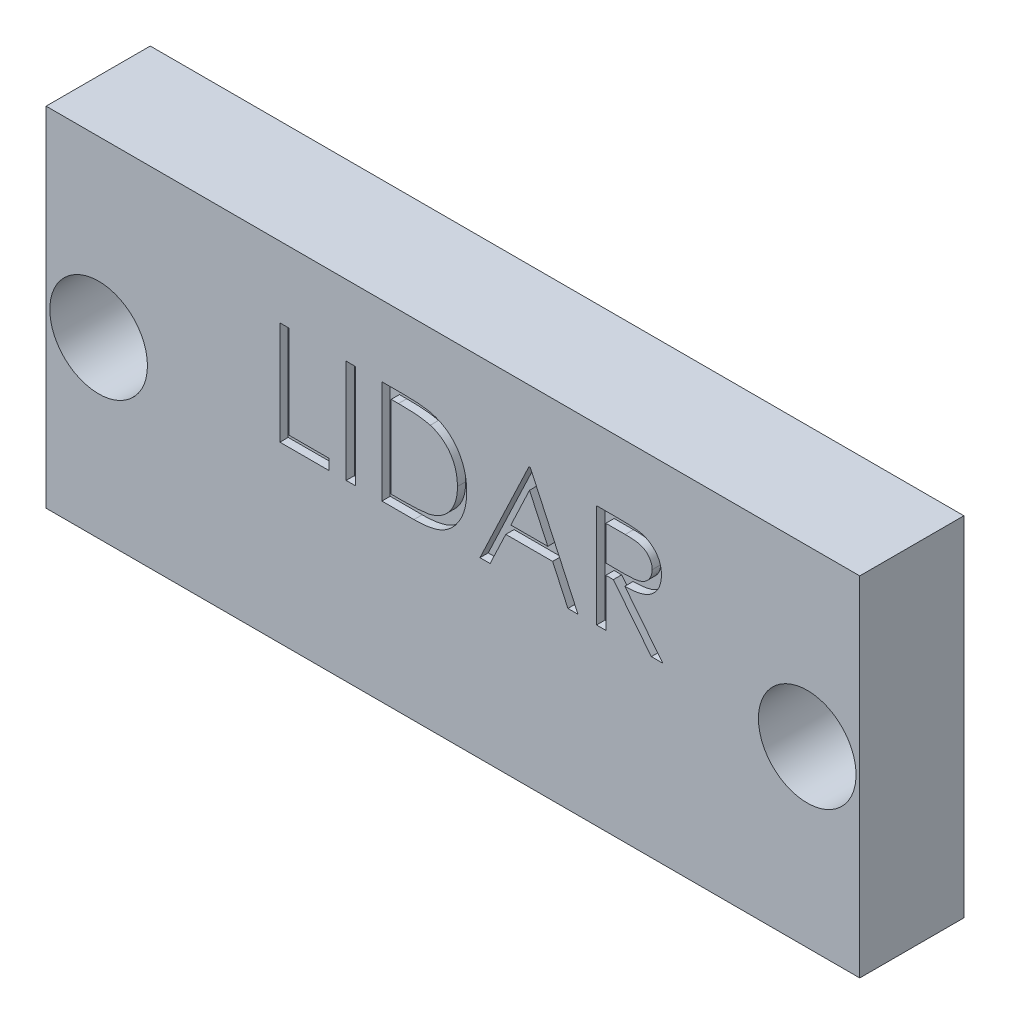
from build123d import *

# Parameters (mm, degrees)
SKETCH2_W           = 25
SKETCH2_H           = 10.7
BOSS_EXTRUDE1_DEPTH = 3.2
SKETCH3_R           = 1.5
CUT_EXTRUDE2_DEPTH  = 3.2
SKETCH4_W           = 0.284935898
SKETCH4_H           = 3.175
CUT_EXTRUDE3_DEPTH  = 0.254


with BuildPart() as part:
    # Sketch2 → Boss-Extrude1 (new body)
    with BuildSketch(Plane.XY):
        with Locations((0.072254335, -5.35)):
            Rectangle(SKETCH2_W, SKETCH2_H)
    extrude(amount=BOSS_EXTRUDE1_DEPTH)

    # Sketch3 → Cut-Extrude2 (cut)
    with BuildSketch(Plane.XY.offset(3.2)):
        with Locations((-10.814046376, -5.35)):
            Circle(SKETCH3_R)
        with Locations(Location((10.958555047, -5.35, 0), (0, 0, 180))):
            Circle(SKETCH3_R)
    extrude(amount=-CUT_EXTRUDE2_DEPTH, mode=Mode.SUBTRACT)

    # Sketch4 → Cut-Extrude3 (cut)
    # profile 1 of 5: a face of its own
    with BuildSketch(Plane.XY.offset(3.2)):
        Polygon((-5.243533556, -2.175), (-4.958597658, -2.175), (-4.958597658, -5.024358974), (-3.737443812, -5.024358974), (-3.737443812, -5.35), (-5.243533556, -5.35), align=None)
    # profile 2 of 5: a face of its own
    with BuildSketch(Plane.XY.offset(3.2)):
        with Locations((-3.065809197, -3.7625)):
            Rectangle(SKETCH4_W, SKETCH4_H)
    # profile 3 of 5: a face of its own
    with BuildSketch(Plane.XY.offset(3.2)):
        with BuildLine():
            Line((-2.109238684, -5.35), (-2.109238684, -2.175))
            Line((-2.109238684, -2.175), (-1.468132915, -2.175))
            add(Edge.make_bspline(
                [(-1.468132915, -2.175), (-1.412371761, -2.175401474), (-1.304641503, -2.17617712), (-1.148964497, -2.181095097), (-1.004924941, -2.189795019), (-0.872996561, -2.202467375), (-0.752817176, -2.218027627), (-0.644723296, -2.237531565), (-0.548155995, -2.260562263), (-0.48876586, -2.280197778), (-0.460680992, -2.289483173)],
                knots=[0, 0, 0, 0, 1.314313732, 2.53924729, 3.670748893, 4.714932338, 5.66265055, 6.526160246, 7.303039223, 8, 8, 8, 8], degree=3))
            add(Edge.make_bspline(
                [(-0.460680992, -2.289483173), (-0.423946478, -2.303481027), (-0.351310468, -2.331159311), (-0.247889721, -2.383371099), (-0.150530285, -2.442528698), (-0.05871006, -2.508710088), (0.025473546, -2.583789176), (0.105309281, -2.664576675), (0.177531209, -2.754010383), (0.243669449, -2.850235551), (0.303301083, -2.952118627), (0.355134462, -3.059465476), (0.398182013, -3.171730943), (0.433917297, -3.288602827), (0.462080869, -3.410338113), (0.481295908, -3.537078548), (0.493969591, -3.668323242), (0.495243266, -3.757381505), (0.495889521, -3.802569111)],
                knots=[0, 0, 0, 0, 0.984719456, 1.947108742, 2.898477687, 3.838006223, 4.779231079, 5.722358779, 6.681677486, 7.655904652, 8.64651281, 9.637519902, 10.640069247, 11.656948941, 12.698408672, 13.768548281, 14.867775369, 16, 16, 16, 16], degree=3))
            add(Edge.make_bspline(
                [(0.495889521, -3.802569111), (0.495318958, -3.841813234), (0.494194603, -3.919147878), (0.484098724, -4.033122119), (0.46942449, -4.143715145), (0.446705825, -4.250400316), (0.419126402, -4.354112342), (0.383780351, -4.453745878), (0.343289579, -4.550214905), (0.296072904, -4.642215044), (0.244237505, -4.729376388), (0.188609923, -4.811541332), (0.129249492, -4.887537426), (0.065590168, -4.95759481), (-0.001545403, -5.02160787), (-0.07259676, -5.080111341), (-0.147747242, -5.131960502), (-0.226660255, -5.179192807), (-0.311637886, -5.220395558), (-0.404289708, -5.255257067), (-0.505010848, -5.284146497), (-0.61355408, -5.308250095), (-0.730106949, -5.327370219), (-0.854783725, -5.340184875), (-0.987392852, -5.34885075), (-1.078451186, -5.349609478), (-1.125319413, -5.35)],
                knots=[0, 0, 0, 0, 1.105936401, 2.179363191, 3.223086493, 4.248585256, 5.251745608, 6.245858792, 7.225916811, 8.198733463, 9.158002045, 10.082870192, 10.993790845, 11.873723703, 12.748670949, 13.606408763, 14.465103618, 15.319838547, 16.196477973, 17.123216899, 18.106603292, 19.147568657, 20.255746949, 21.433717677, 22.679120308, 24, 24, 24, 24], degree=3))
            Line((-1.125319413, -5.35), (-2.109238684, -5.35))
        make_face()
        with BuildLine():
            Line((-1.824302787, -5.024358974), (-1.459864686, -5.024358974))
            add(Edge.make_bspline(
                [(-1.459864686, -5.024358974), (-1.407496806, -5.024133916), (-1.306774196, -5.023701045), (-1.161941585, -5.019902653), (-1.029608132, -5.013696039), (-0.909755049, -5.005010075), (-0.802450005, -4.993517832), (-0.707468746, -4.980704527), (-0.625122619, -4.964741125), (-0.575293773, -4.950271326), (-0.55226753, -4.943584736)],
                knots=[0, 0, 0, 0, 1.375205317, 2.645023457, 3.804390687, 4.853969522, 5.800190428, 6.637939096, 7.370582563, 8, 8, 8, 8], degree=3))
            add(Edge.make_bspline(
                [(-0.55226753, -4.943584736), (-0.523285802, -4.933377965), (-0.466014573, -4.913208212), (-0.383572445, -4.876416619), (-0.306685734, -4.832835599), (-0.234014497, -4.784392108), (-0.166589602, -4.72937752), (-0.103612011, -4.668988123), (-0.04520852, -4.602916577), (0.00801746, -4.531244888), (0.055649992, -4.454419144), (0.096898893, -4.373194631), (0.133049926, -4.28846131), (0.161424078, -4.198918002), (0.183663215, -4.105365213), (0.199415467, -4.007796363), (0.209225967, -3.906229671), (0.210370281, -3.837148816), (0.210953624, -3.801933093)],
                knots=[0, 0, 0, 0, 0.998632004, 1.973411704, 2.929992603, 3.868527914, 4.809262121, 5.754881198, 6.702106254, 7.672490631, 8.653608572, 9.636854334, 10.631411391, 11.644891563, 12.686317036, 13.754757253, 14.855430412, 16, 16, 16, 16], degree=3))
            add(Edge.make_bspline(
                [(0.210953624, -3.801933093), (0.210487999, -3.764800579), (0.209573274, -3.691853426), (0.198075864, -3.584819009), (0.181274167, -3.481875848), (0.156977538, -3.383017056), (0.126015955, -3.288049765), (0.08737653, -3.19749921), (0.043228954, -3.110409079), (-0.009297645, -3.028789475), (-0.066824647, -2.951597869), (-0.130667438, -2.880881624), (-0.199811715, -2.816479652), (-0.273503329, -2.75738899), (-0.353819126, -2.705986941), (-0.438867117, -2.66000688), (-0.529894976, -2.620985322), (-0.593225064, -2.600230925), (-0.625409557, -2.589683494)],
                knots=[0, 0, 0, 0, 1.122418816, 2.205001699, 3.251619955, 4.274784885, 5.280384055, 6.268708349, 7.249350384, 8.229342522, 9.199999885, 10.157847722, 11.105861043, 12.055065948, 13.010012805, 13.98527497, 14.976112212, 16, 16, 16, 16], degree=3))
            add(Edge.make_bspline(
                [(-0.625409557, -2.589683494), (-0.65203524, -2.582320734), (-0.708648747, -2.566665487), (-0.801031689, -2.549588185), (-0.905004004, -2.534525532), (-1.021027304, -2.521772882), (-1.148969335, -2.512622241), (-1.288928494, -2.505753977), (-1.440965279, -2.501121532), (-1.546359434, -2.500805204), (-1.601060599, -2.500641026)],
                knots=[0, 0, 0, 0, 0.674548936, 1.434276114, 2.292660221, 3.240891867, 4.284742987, 5.42552168, 6.663806718, 8, 8, 8, 8], degree=3))
            Line((-1.601060599, -2.500641026), (-1.824302787, -2.500641026))
            Line((-1.824302787, -2.500641026), (-1.824302787, -5.024358974))
        make_face(mode=Mode.SUBTRACT)
    # profile 4 of 5: a face of its own
    with BuildSketch(Plane.XY.offset(3.2)):
        Polygon((2.449735675, -2.175), (3.91512029, -5.35), (3.605379705, -5.35), (3.135998696, -4.332371795), (1.696690803, -4.332371795), (1.214589441, -5.35), (0.902940803, -5.35), (2.409030547, -2.175), align=None)
        Polygon((2.426203023, -2.79448117), (1.851879104, -4.006730769), (2.985898536, -4.006730769), align=None, mode=Mode.SUBTRACT)
    # profile 5 of 5: a face of its own
    with BuildSketch(Plane.XY.offset(3.2)):
        with BuildLine():
            Line((4.484992085, -2.175), (5.120373696, -2.175))
            add(Edge.make_bspline(
                [(5.120373696, -2.175), (5.162774577, -2.175141139), (5.244188965, -2.175412141), (5.360823289, -2.176923226), (5.466802155, -2.181254248), (5.562070152, -2.18498132), (5.646625532, -2.191777582), (5.720727574, -2.198273311), (5.784034986, -2.206776561), (5.822358008, -2.214673623), (5.839709633, -2.218249199)],
                knots=[0, 0, 0, 0, 1.410062039, 2.707475311, 3.878576406, 4.937260626, 5.877586885, 6.699081471, 7.410979367, 8, 8, 8, 8], degree=3))
            add(Edge.make_bspline(
                [(5.839709633, -2.218249199), (5.862938499, -2.223988479), (5.908900697, -2.235344604), (5.975076828, -2.259347242), (6.038136251, -2.287123616), (6.09781702, -2.319747848), (6.153820202, -2.357462112), (6.206723241, -2.399615338), (6.256766197, -2.445976874), (6.301925247, -2.497715623), (6.344505673, -2.551995886), (6.380418213, -2.610691437), (6.411375805, -2.672070108), (6.436023345, -2.736756123), (6.455869793, -2.804122159), (6.469863596, -2.874778424), (6.478255744, -2.948403023), (6.479110142, -2.998620555), (6.479543367, -3.024083534)],
                knots=[0, 0, 0, 0, 1.027469482, 2.033020251, 3.019912614, 3.986113645, 4.951240523, 5.91722682, 6.890402269, 7.87763091, 8.8651537, 9.85103654, 10.82876324, 11.815024772, 12.821070561, 13.842952187, 14.906261191, 16, 16, 16, 16], degree=3))
            add(Edge.make_bspline(
                [(6.479543367, -3.024083534), (6.478210776, -3.066388236), (6.475610546, -3.148935667), (6.451367059, -3.268733752), (6.411655502, -3.380484059), (6.356933661, -3.48404588), (6.287247422, -3.577400537), (6.203495647, -3.659397593), (6.105631614, -3.728013799), (6.014527877, -3.775595987), (5.934051425, -3.806069554), (5.867799777, -3.827511108), (5.795530447, -3.844077319), (5.717935865, -3.858918296), (5.634693121, -3.870123047), (5.546001728, -3.878329601), (5.451798433, -3.883458631), (5.387083706, -3.884222449), (5.353792165, -3.884615385)],
                knots=[0, 0, 0, 0, 1.260483769, 2.459530307, 3.627416485, 4.787058657, 5.939039949, 7.08810263, 8.267026773, 9.491475466, 10.141966685, 10.831826277, 11.566392101, 12.351337768, 13.187381173, 14.07005841, 15.007169909, 16, 16, 16, 16], degree=3))
            Line((5.353792165, -3.884615385), (6.520248495, -5.35))
            Line((6.520248495, -5.35), (6.167894729, -5.35))
            Line((6.167894729, -5.35), (5.001438399, -3.884615385))
            Line((5.001438399, -3.884615385), (4.769927983, -3.884615385))
            Line((4.769927983, -3.884615385), (4.769927983, -5.35))
            Line((4.769927983, -5.35), (4.484992085, -5.35))
            Line((4.484992085, -5.35), (4.484992085, -2.175))
        make_face()
        with BuildLine():
            Line((4.769927983, -2.500641026), (4.769927983, -3.558974359))
            Line((4.769927983, -3.558974359), (5.351248095, -3.563426482))
            add(Edge.make_bspline(
                [(5.351248095, -3.563426482), (5.378389844, -3.56343849), (5.430998286, -3.563461764), (5.507108174, -3.559838838), (5.577974276, -3.5557174), (5.643325529, -3.54941335), (5.70319113, -3.541288914), (5.757541155, -3.531126207), (5.806464323, -3.519286121), (5.863522283, -3.500960361), (5.927236851, -3.47192633), (5.996480389, -3.429684771), (6.055446796, -3.376554212), (6.105265142, -3.31579972), (6.145296841, -3.249001123), (6.173519919, -3.176959131), (6.191429134, -3.101492467), (6.193541458, -3.049623755), (6.19460747, -3.023447516)],
                knots=[0, 0, 0, 0, 1.146690395, 2.22261258, 3.21895312, 4.145990853, 4.996080663, 5.770904154, 6.481378293, 7.121626537, 8.300444488, 9.431385265, 10.535395872, 11.636531494, 12.74115979, 13.810798291, 14.895190096, 16, 16, 16, 16], degree=3))
            add(Edge.make_bspline(
                [(6.19460747, -3.023447516), (6.193516974, -2.997914553), (6.19135601, -2.947317536), (6.173713199, -2.87324396), (6.143877831, -2.803333227), (6.10367123, -2.73786973), (6.054686282, -2.67844667), (5.99724798, -2.627603895), (5.932926839, -2.585649024), (5.872809395, -2.558838978), (5.819075502, -2.542401683), (5.772421453, -2.530834556), (5.719706041, -2.521541359), (5.660673304, -2.514095475), (5.595575253, -2.507695633), (5.524082734, -2.503385091), (5.446670083, -2.500832514), (5.393015367, -2.500706341), (5.365240483, -2.500641026)],
                knots=[0, 0, 0, 0, 1.101028733, 2.181837193, 3.264309656, 4.369019818, 5.486613113, 6.575447106, 7.666700264, 8.788928104, 9.402425223, 10.0903467, 10.862060571, 11.710948788, 12.657782767, 13.684531032, 14.801375019, 16, 16, 16, 16], degree=3))
            Line((5.365240483, -2.500641026), (4.769927983, -2.500641026))
        make_face(mode=Mode.SUBTRACT)
    extrude(amount=-CUT_EXTRUDE3_DEPTH, mode=Mode.SUBTRACT)


solid = part.part
